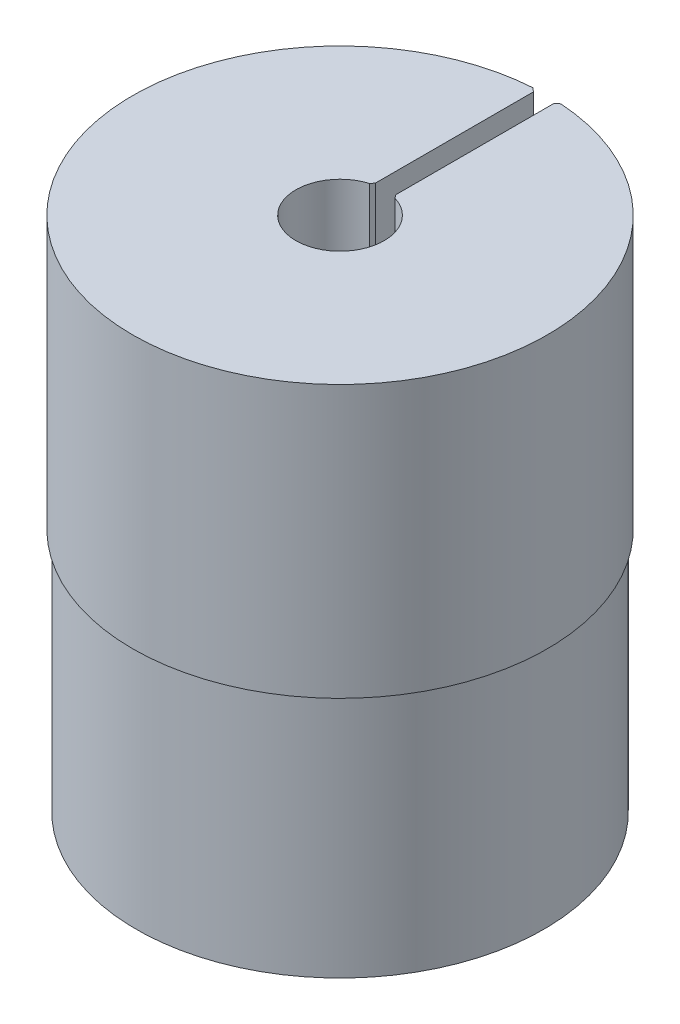
from build123d import *

# Parameters (mm, degrees)
SKETCH1_R           = 7.5
BOSS_EXTRUDE1_DEPTH = 9
SKETCH2_R           = 1.75
CUT_EXTRUDE1_DEPTH  = 14.910427743
SKETCH4_W           = 1
SKETCH4_H           = 6.379821958
CUT_EXTRUDE2_DEPTH  = 9
BOSS_EXTRUDE2_DEPTH = 10


with BuildPart() as part:
    # Sketch1 → Boss-Extrude1 (new body)
    with BuildSketch(Plane(origin=(0, 0, 0), x_dir=(1, 0, 0), z_dir=(0, 1, 0))):
        Circle(SKETCH1_R)
    extrude(amount=BOSS_EXTRUDE1_DEPTH)

    # Sketch2 → Cut-Extrude1 (cut, through all)
    with BuildSketch(Plane(origin=(0, 9, 0), x_dir=(1, 0, 0), z_dir=(0, 1, 0))):
        Circle(SKETCH2_R)
    extrude(amount=-CUT_EXTRUDE1_DEPTH, mode=Mode.SUBTRACT)

    # Sketch4 → Cut-Extrude2 (cut)
    with BuildSketch(Plane(origin=(0, 9, 0), x_dir=(1, 0, 0), z_dir=(0, 1, 0))):
        with Locations((0, 4.574678536)):
            Rectangle(SKETCH4_W, SKETCH4_H)
    extrude(amount=-CUT_EXTRUDE2_DEPTH, mode=Mode.SUBTRACT)

    # Sketch5 → Boss-Extrude2 (add)
    with BuildSketch(Plane(origin=(0, 9, 0), x_dir=(1, 0, 0), z_dir=(0, 1, 0))):
        with BuildLine():
            Line((0.373, 7.483314774), (0.373, 1.677050983))
            Line((0.373, 1.677050983), (0.463714286, 1.555344997))
            ThreePointArc((0.463714286, 1.555344997), (0, -1.623), (-0.463714286, 1.555344997))
            Line((-0.463714286, 1.555344997), (-0.373, 1.677050983))
            Line((-0.373, 1.677050983), (-0.373, 7.483314774))
            Line((-0.373, 7.483314774), (-0.508466667, 7.610032237))
            ThreePointArc((-0.508466667, 7.610032237), (0, -7.627), (0.508466667, 7.610032237))
            Line((0.508466667, 7.610032237), (0.373, 7.483314774))
        make_face()
    extrude(amount=BOSS_EXTRUDE2_DEPTH)


solid = part.part
